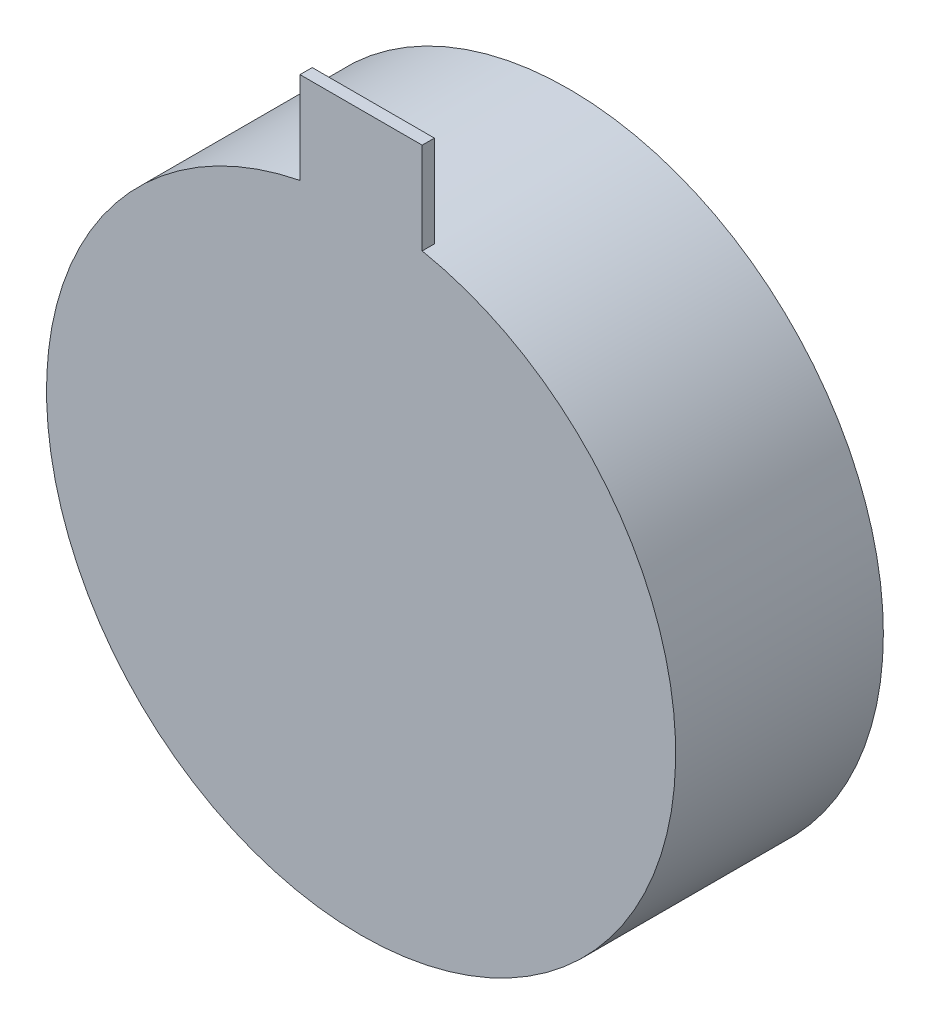
from build123d import *

# Parameters (mm, degrees)
ESQUISSE1_R        = 5.15
BOSS_EXTRU_1_DEPTH = 3.4
ESQUISSE2_W        = 2
ESQUISSE2_H        = 1.5
BOSS_EXTRU_2_DEPTH = 0.2


with BuildPart() as part:
    # Esquisse1 → Boss.-Extru.1 (new body)
    with BuildSketch(Plane.XY):
        Circle(ESQUISSE1_R)
    extrude(amount=BOSS_EXTRU_1_DEPTH)

    # Esquisse2 → Boss.-Extru.2 (add)
    with BuildSketch(Plane.XY.offset(3.4)):
        with Locations((0, 5.80197981)):
            Rectangle(ESQUISSE2_W, ESQUISSE2_H)
    extrude(amount=-BOSS_EXTRU_2_DEPTH)


solid = part.part
